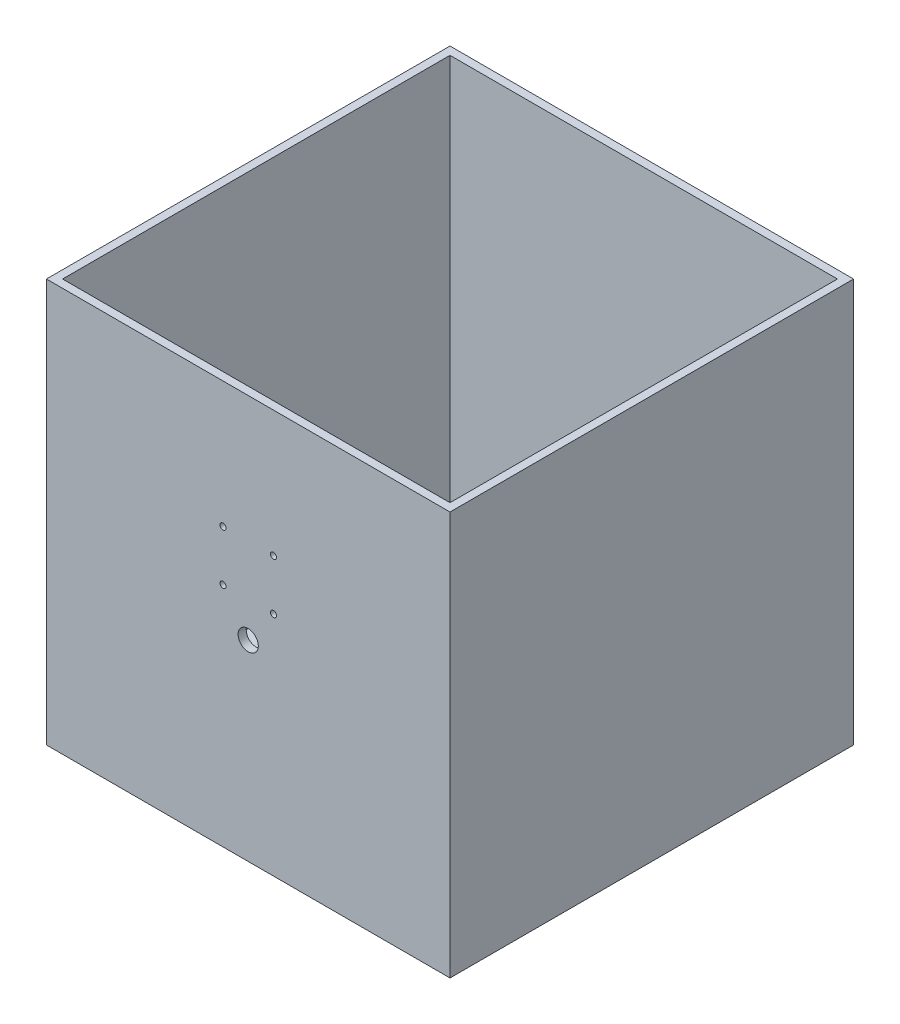
from build123d import *

# Parameters (mm, degrees)
SKETCH1_W           = 200
SKETCH1_H           = 200
BOSS_EXTRUDE1_DEPTH = 200
SHELL1_T            = -4
CUT_EXTRUDE1_REACH  = 302
SKETCH2_R           = 1.5
SKETCH2_R_2         = 5


with BuildPart() as part:
    # Sketch1 → Boss-Extrude1 (new body)
    with BuildSketch(Plane(origin=(0, 0, 0), x_dir=(1, 0, 0), z_dir=(0, 1, 0))):
        Rectangle(SKETCH1_W, SKETCH1_H)
    extrude(amount=BOSS_EXTRUDE1_DEPTH)

    # Shell1
    shell1_openings = [part.faces().sort_by_distance(p)[0] for p in [
        (0, 200, 0),
    ]]
    offset(amount=SHELL1_T, openings=shell1_openings, kind=Kind.INTERSECTION)

    # Sketch2 → Cut-Extrude1 (cut, up to next)
    with BuildSketch(Plane.XY.offset(100), mode=Mode.PRIVATE) as cut_extrude1_sk1:
        with Locations((-12.5, 137.5)):
            Circle(SKETCH2_R)
    cut_extrude1_tool1 = extrude(cut_extrude1_sk1.sketch, amount=-CUT_EXTRUDE1_REACH, mode=Mode.PRIVATE) & part.part
    # Sketch2 → Cut-Extrude1 (cut, up to next)
    with BuildSketch(Plane.XY.offset(100), mode=Mode.PRIVATE) as cut_extrude1_sk2:
        with Locations((12.5, 137.5)):
            Circle(SKETCH2_R)
    cut_extrude1_tool2 = extrude(cut_extrude1_sk2.sketch, amount=-CUT_EXTRUDE1_REACH, mode=Mode.PRIVATE) & part.part
    # Sketch2 → Cut-Extrude1 (cut, up to next)
    with BuildSketch(Plane.XY.offset(100), mode=Mode.PRIVATE) as cut_extrude1_sk3:
        with Locations((12.5, 112.5)):
            Circle(SKETCH2_R)
    cut_extrude1_tool3 = extrude(cut_extrude1_sk3.sketch, amount=-CUT_EXTRUDE1_REACH, mode=Mode.PRIVATE) & part.part
    # Sketch2 → Cut-Extrude1 (cut, up to next)
    with BuildSketch(Plane.XY.offset(100), mode=Mode.PRIVATE) as cut_extrude1_sk4:
        with Locations((-12.5, 112.5)):
            Circle(SKETCH2_R)
    cut_extrude1_tool4 = extrude(cut_extrude1_sk4.sketch, amount=-CUT_EXTRUDE1_REACH, mode=Mode.PRIVATE) & part.part
    # Sketch2 → Cut-Extrude1 (cut, up to next)
    with BuildSketch(Plane.XY.offset(100), mode=Mode.PRIVATE) as cut_extrude1_sk5:
        with Locations((0, 95)):
            Circle(SKETCH2_R_2)
    cut_extrude1_tool5 = extrude(cut_extrude1_sk5.sketch, amount=-CUT_EXTRUDE1_REACH, mode=Mode.PRIVATE) & part.part
    add(cut_extrude1_tool1.solids().sort_by_distance((-12.5, 137.5, 100))[0], mode=Mode.SUBTRACT)
    add(cut_extrude1_tool2.solids().sort_by_distance((12.5, 137.5, 100))[0], mode=Mode.SUBTRACT)
    add(cut_extrude1_tool3.solids().sort_by_distance((12.5, 112.5, 100))[0], mode=Mode.SUBTRACT)
    add(cut_extrude1_tool4.solids().sort_by_distance((-12.5, 112.5, 100))[0], mode=Mode.SUBTRACT)
    add(cut_extrude1_tool5.solids().sort_by_distance((0, 95, 100))[0], mode=Mode.SUBTRACT)


solid = part.part
